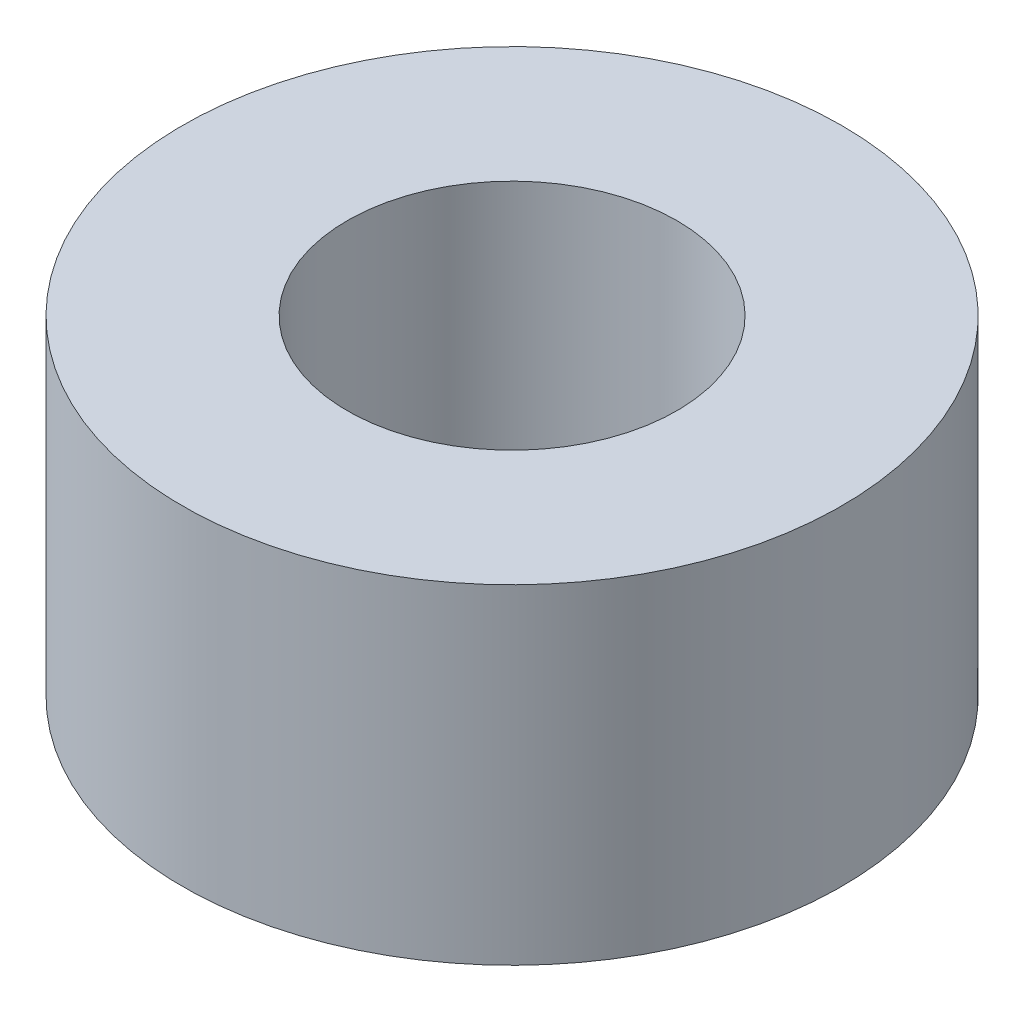
from build123d import *

# Parameters (mm, degrees)
SKETCH1_R           = 9.525
SKETCH1_R_2         = 4.7625
BOSS_EXTRUDE1_DEPTH = 9.525


with BuildPart() as part:
    # Sketch1 → Boss-Extrude1 (new body)
    with BuildSketch(Plane(origin=(0, 0, 0), x_dir=(1, 0, 0), z_dir=(0, 1, 0))):
        with Locations(Location((0, 0, 0), (0, 0, 90))):
            Circle(SKETCH1_R)
        with Locations(Location((0, 0, 0), (0, 0, 90))):
            Circle(SKETCH1_R_2, mode=Mode.SUBTRACT)
    extrude(amount=BOSS_EXTRUDE1_DEPTH)


solid = part.part
